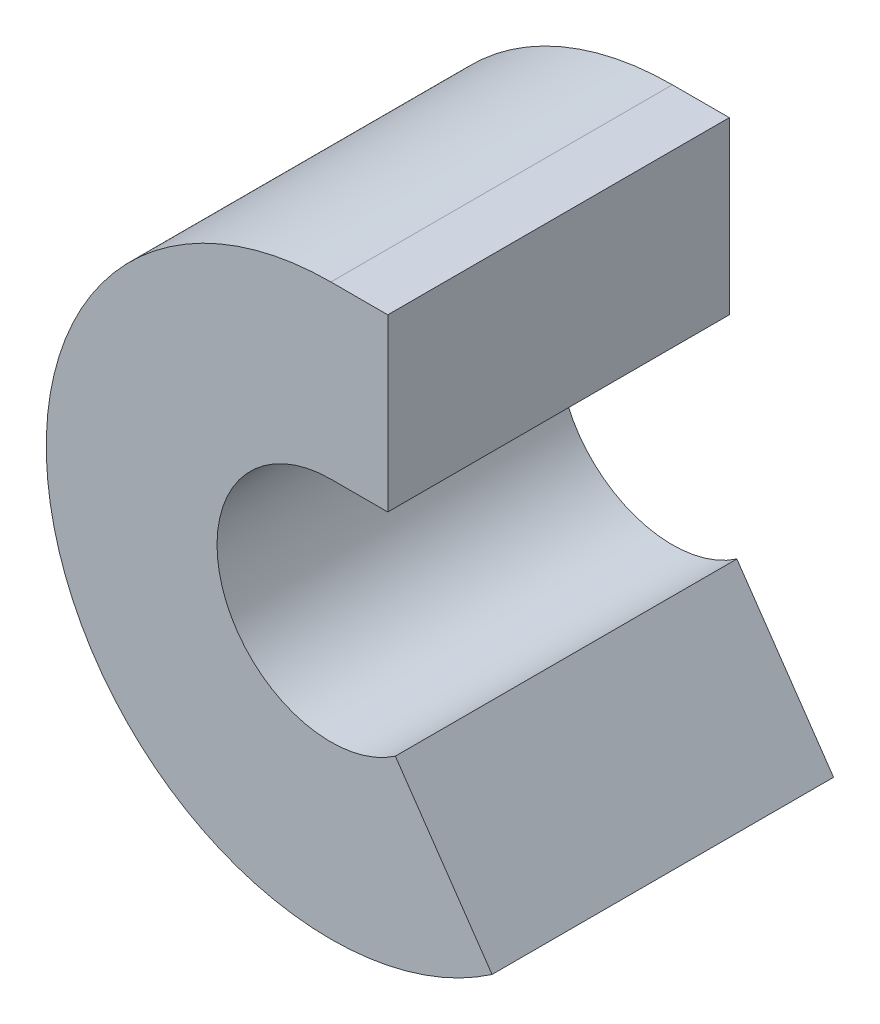
from build123d import *

# Parameters (mm, degrees)
BOSS_EXTRUDE1_DEPTH = 76.2


with BuildPart() as part:
    # Sketch1 → Boss-Extrude1 (new body)
    with BuildSketch(Plane.XY):
        with BuildLine():
            ThreePointArc((-263.258240929, -25.4), (-288.658240929, 0), (-263.258240929, 25.4))
            Line((-263.258240929, 25.4), (-250.558240929, 25.4))
            Line((-250.558240929, 25.4), (-250.558240929, 63.5))
            Line((-250.558240929, 63.5), (-263.217595671, 63.5))
            Line((-263.217595671, 63.5), (-263.258240929, 63.5))
            ThreePointArc((-263.258240929, 63.5), (-326.758240929, 0), (-263.258240929, -63.5))
            ThreePointArc((-263.258240929, -63.5), (-244.427108864, -60.643536054), (-227.290164194, -52.33113276))
            Line((-227.290164194, -52.33113276), (-248.871010235, -20.932453104))
            ThreePointArc((-248.871010235, -20.932453104), (-255.725788103, -24.257414422), (-263.258240929, -25.4))
        make_face()
    extrude(amount=BOSS_EXTRUDE1_DEPTH)


solid = part.part
